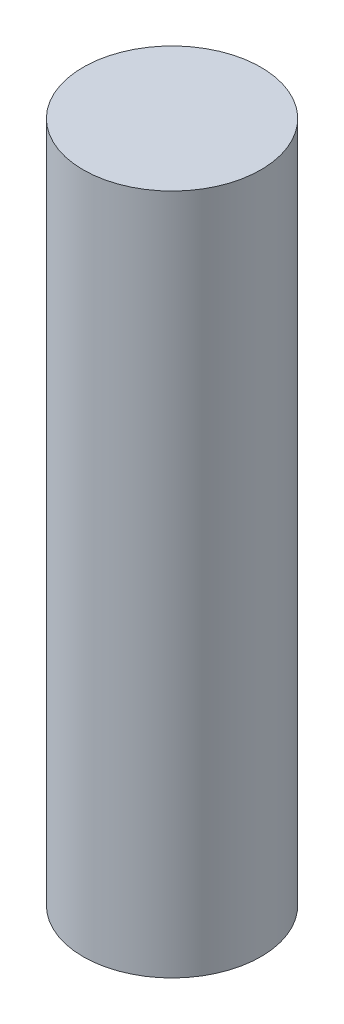
from build123d import *

# Parameters (mm, degrees)
SKETCH1_R           = 1.5
BOSS_EXTRUDE1_DEPTH = 11.5


with BuildPart() as part:
    # Sketch1 → Boss-Extrude1 (new body)
    with BuildSketch(Plane(origin=(0, 0, 0), x_dir=(1, 0, 0), z_dir=(0, 1, 0))):
        with Locations(Location((0, 0, 0), (0, 0, 270))):
            Circle(SKETCH1_R)
    extrude(amount=BOSS_EXTRUDE1_DEPTH)


solid = part.part
